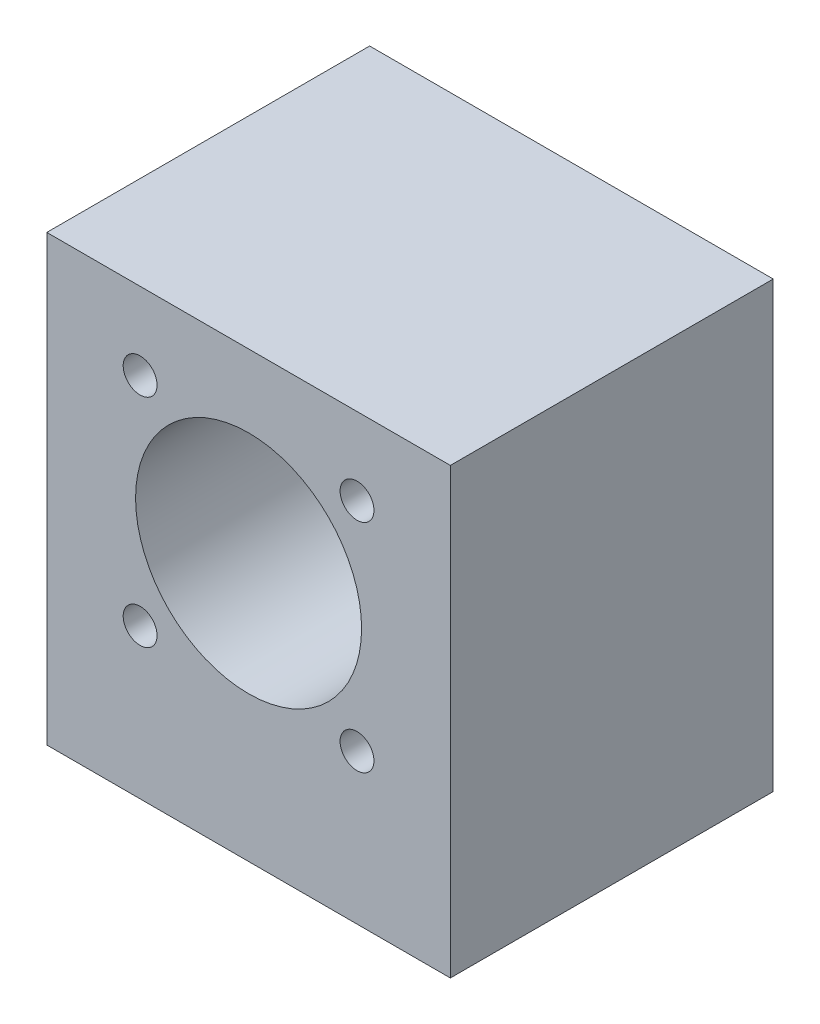
from build123d import *

# Parameters (mm, degrees)
SKETCH1_W             = 50
SKETCH1_H             = 55
BOSS_EXTRUDE1_DEPTH   = 40
SKETCH2_R             = 14
CUT_EXTRUDE1_DEPTH    = 55.60082417
M5_TAPPED_HOLE1_D     = 4.2
M5_TAPPED_HOLE1_DEPTH = 15
M5_TAPPED_HOLE1_TIP   = 1.2618073
M5_TAPPED_HOLE3_D     = 4.2
M5_TAPPED_HOLE3_DEPTH = 17.4
M5_TAPPED_HOLE3_TIP   = 1.2618073


with BuildPart() as part:
    # Sketch1 → Boss-Extrude1 (new body)
    with BuildSketch(Plane.XY):
        Rectangle(SKETCH1_W, SKETCH1_H)
    extrude(amount=-BOSS_EXTRUDE1_DEPTH)

    # Sketch2 → Cut-Extrude1 (cut, through all)
    with BuildSketch(Plane.XY):
        with Locations((0, 4.5)):
            Circle(SKETCH2_R)
    extrude(amount=-CUT_EXTRUDE1_DEPTH, mode=Mode.SUBTRACT)

    # M5 Tapped Hole1
    with Locations(Plane(origin=(-10, -27.5, -10), x_dir=(-1, 0, 0), z_dir=(0, -1, 0))):
        with Locations((0, 0), (-20, 0), (-20, 20), (0, 20)):
            Hole(M5_TAPPED_HOLE1_D / 2, depth=M5_TAPPED_HOLE1_DEPTH)
            with Locations((0, 0, -(M5_TAPPED_HOLE1_DEPTH + M5_TAPPED_HOLE1_TIP / 2))):  # 118° drill point
                Cone(0, M5_TAPPED_HOLE1_D / 2, M5_TAPPED_HOLE1_TIP, mode=Mode.SUBTRACT)

    # M5 Tapped Hole3
    with Locations(Plane(origin=(13.435028843, 17.935028843, 0), x_dir=(1, 0, 0), z_dir=(0, 0, 1))):
        with Locations((0, 0), (0, -26.870057686), (-26.870057686, -26.870057686), (-26.870057686, 0)):
            Hole(M5_TAPPED_HOLE3_D / 2, depth=M5_TAPPED_HOLE3_DEPTH)
            with Locations((0, 0, -(M5_TAPPED_HOLE3_DEPTH + M5_TAPPED_HOLE3_TIP / 2))):  # 118° drill point
                Cone(0, M5_TAPPED_HOLE3_D / 2, M5_TAPPED_HOLE3_TIP, mode=Mode.SUBTRACT)


solid = part.part
